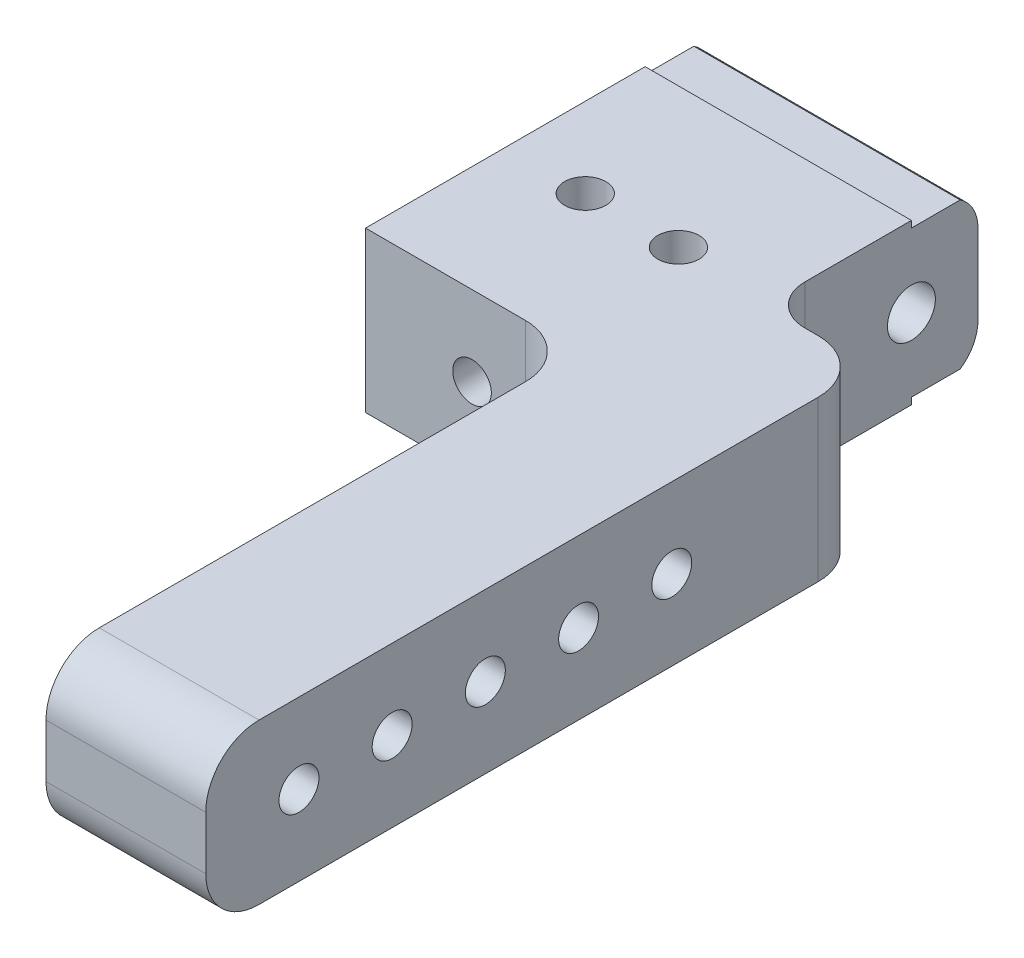
from build123d import *

# Parameters (mm, degrees)
SKETCH1_W           = 20
SKETCH1_H           = 12
BOSS_EXTRUDE1_DEPTH = 26
SKETCH2_W           = 10
SKETCH2_H           = 12
BOSS_EXTRUDE2_DEPTH = 8
SKETCH4_R           = 1.55
CUT_EXTRUDE2_DEPTH  = 41.049968789
FILLET1_R           = 3
FILLET3_R           = 3
SKETCH5_W           = 9.976745634
SKETCH5_H           = 0.5
SKETCH5_W_2         = 12.25993895
CUT_EXTRUDE3_DEPTH  = 41.049968789
SKETCH6_W           = 5.5
SKETCH6_H           = 30.488056323
CUT_EXTRUDE4_DEPTH  = 0.8
SKETCH8_W           = 12
SKETCH8_H           = 12
BOSS_EXTRUDE3_DEPTH = 40
SKETCH3_R           = 1.8
CUT_EXTRUDE1_DEPTH  = 73.691127382
SKETCH9_R           = 1.5
CUT_EXTRUDE6_DEPTH  = 12
FILLET4_R           = 4
SKETCH10_R          = 1.45
CUT_EXTRUDE7_DEPTH  = 12
FILLET5_R           = 4
FILLET7_R           = 4


with BuildPart() as part:
    # Sketch1 → Boss-Extrude1 (new body)
    with BuildSketch(Plane.XY):
        with Locations((10, -6)):
            Rectangle(SKETCH1_W, SKETCH1_H)
    extrude(amount=BOSS_EXTRUDE1_DEPTH)

    # Sketch2 → Boss-Extrude2 (add)
    with BuildSketch(Plane(origin=(20, 0, 0), x_dir=(0, 0, -1), z_dir=(1, 0, 0))):
        with Locations((-21, -6)):
            Rectangle(SKETCH2_W, SKETCH2_H)
    extrude(amount=BOSS_EXTRUDE2_DEPTH)

    # Sketch4 → Cut-Extrude2 (cut, through all)
    with BuildSketch(Plane(origin=(0, 0, 0), x_dir=(1, 0, 0), z_dir=(0, 1, 0))):
        with Locations(Location((13, -15.5, 0), (0, 0, 270))):
            Circle(SKETCH4_R)
        with Locations(Location((6, -15.5, 0), (0, 0, 270))):
            Circle(SKETCH4_R)
    extrude(amount=-CUT_EXTRUDE2_DEPTH, mode=Mode.SUBTRACT)

    # Fillet1
    fillet1_edges = [part.edges().sort_by_distance(p)[0] for p in [
        (20, -6, 16),
    ]]
    fillet(fillet1_edges, radius=FILLET1_R)

    # Fillet3
    fillet3_edges = [part.edges().sort_by_distance(p)[0] for p in [
        (10, 0, 0),
        (10, -12, 0),
    ]]
    fillet(fillet3_edges, radius=FILLET3_R)

    # Sketch5 → Cut-Extrude3 (cut, through all)
    with BuildSketch(Plane.ZY):
        with Locations((0.011627183, -11.75)):
            Rectangle(SKETCH5_W, SKETCH5_H)
        with Locations((-1.129969475, -0.25)):
            Rectangle(SKETCH5_W_2, SKETCH5_H)
    extrude(amount=-CUT_EXTRUDE3_DEPTH, mode=Mode.SUBTRACT)

    # Sketch6 → Cut-Extrude4 (cut)
    with BuildSketch(Plane(origin=(0, 0, 0), x_dir=(-1, 0, 0), z_dir=(0, 0, -1))):
        with Locations((-10, -7.868232937)):
            Rectangle(SKETCH6_W, SKETCH6_H)
    extrude(amount=-CUT_EXTRUDE4_DEPTH, mode=Mode.SUBTRACT)

    # Sketch8 → Boss-Extrude3 (add)
    with BuildSketch(Plane.XY.offset(26)):
        with Locations((22, -6)):
            Rectangle(SKETCH8_W, SKETCH8_H)
    extrude(amount=BOSS_EXTRUDE3_DEPTH)

    # Sketch3 → Cut-Extrude1 (cut, through all)
    with BuildSketch(Plane.ZY):
        with Locations(Location((5, -6, 0), (0, 0, 270))):
            Circle(SKETCH3_R)
    extrude(amount=-CUT_EXTRUDE1_DEPTH, mode=Mode.SUBTRACT)

    # Sketch9 → Cut-Extrude6 (cut)
    with BuildSketch(Plane(origin=(28, 0, 0), x_dir=(0, 0, -1), z_dir=(1, 0, 0))):
        with Locations((-31, -6)):
            Circle(SKETCH9_R)
        with Locations((-38, -6)):
            Circle(SKETCH9_R)
        with Locations((-45, -6)):
            Circle(SKETCH9_R)
        with Locations((-52, -6)):
            Circle(SKETCH9_R)
        with Locations((-59, -6)):
            Circle(SKETCH9_R)
    extrude(amount=-CUT_EXTRUDE6_DEPTH, mode=Mode.SUBTRACT)

    # Fillet4
    fillet4_edges = [part.edges().sort_by_distance(p)[0] for p in [
        (16, -6, 26),
    ]]
    fillet(fillet4_edges, radius=FILLET4_R)

    # Sketch10 → Cut-Extrude7 (cut)
    with BuildSketch(Plane.XY.offset(26)):
        with Locations((8, -6)):
            Circle(SKETCH10_R)
    extrude(amount=-CUT_EXTRUDE7_DEPTH, mode=Mode.SUBTRACT)

    # Fillet5
    fillet5_edges = [part.edges().sort_by_distance(p)[0] for p in [
        (28, -6, 16),
    ]]
    fillet(fillet5_edges, radius=FILLET5_R)

    # Fillet7
    fillet7_edges = [part.edges().sort_by_distance(p)[0] for p in [
        (22, 0, 66),
        (22, -12, 66),
    ]]
    fillet(fillet7_edges, radius=FILLET7_R)


solid = part.part
